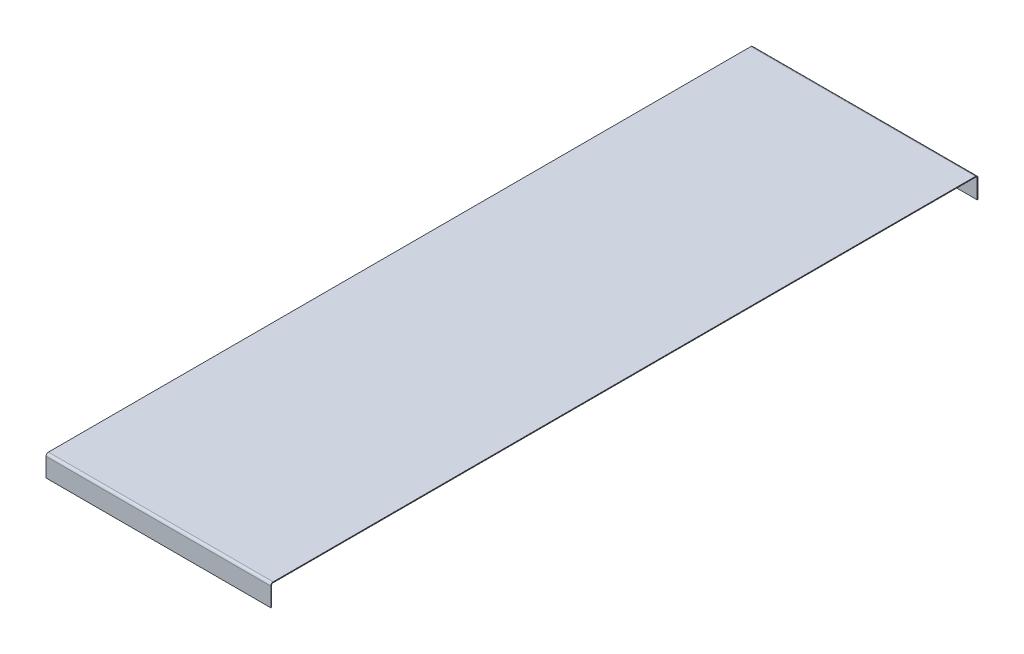
from build123d import *

# Parameters (mm, degrees)
SKETCH1_W           = 139.7
SKETCH1_H           = 439.61
BOSS_EXTRUDE1_DEPTH = 0.5
SKETCH2_W           = 139.7
SKETCH2_H           = 0.5
BOSS_EXTRUDE2_DEPTH = 12.7
FILLET1_R           = 1
FILLET2_R           = 1.5
SKETCH4_W           = 139.7
SKETCH4_H           = 0.5
BOSS_EXTRUDE3_DEPTH = 12.7
FILLET3_R           = 1
FILLET4_R           = 1.5


with BuildPart() as part:
    # Sketch1 → Boss-Extrude1 (new body)
    with BuildSketch(Plane(origin=(0, 0, 0), x_dir=(1, 0, 0), z_dir=(0, 1, 0))):
        with Locations((174.46911026, 72.328904153)):
            Rectangle(SKETCH1_W, SKETCH1_H)
    extrude(amount=BOSS_EXTRUDE1_DEPTH)

    # Sketch2 → Boss-Extrude2 (add)
    with BuildSketch(Plane.XZ):
        with Locations((174.46911026, 147.226095847)):
            Rectangle(SKETCH2_W, SKETCH2_H)
    extrude(amount=BOSS_EXTRUDE2_DEPTH)

    # Fillet1
    fillet1_edges = [part.edges().sort_by_distance(p)[0] for p in [
        (174.46911026, 0, 146.976095847),
    ]]
    fillet(fillet1_edges, radius=FILLET1_R)

    # Fillet2
    fillet2_edges = [part.edges().sort_by_distance(p)[0] for p in [
        (174.46911026, 0.5, 147.476095847),
    ]]
    fillet(fillet2_edges, radius=FILLET2_R)

    # Sketch4 → Boss-Extrude3 (add)
    with BuildSketch(Plane.XZ):
        with Locations((174.46911026, -291.883904153)):
            Rectangle(SKETCH4_W, SKETCH4_H)
    extrude(amount=BOSS_EXTRUDE3_DEPTH)

    # Fillet3
    fillet3_edges = [part.edges().sort_by_distance(p)[0] for p in [
        (174.46911026, 0, -291.633904153),
    ]]
    fillet(fillet3_edges, radius=FILLET3_R)

    # Fillet4
    fillet4_edges = [part.edges().sort_by_distance(p)[0] for p in [
        (174.46911026, 0.5, -292.133904153),
    ]]
    fillet(fillet4_edges, radius=FILLET4_R)


solid = part.part
